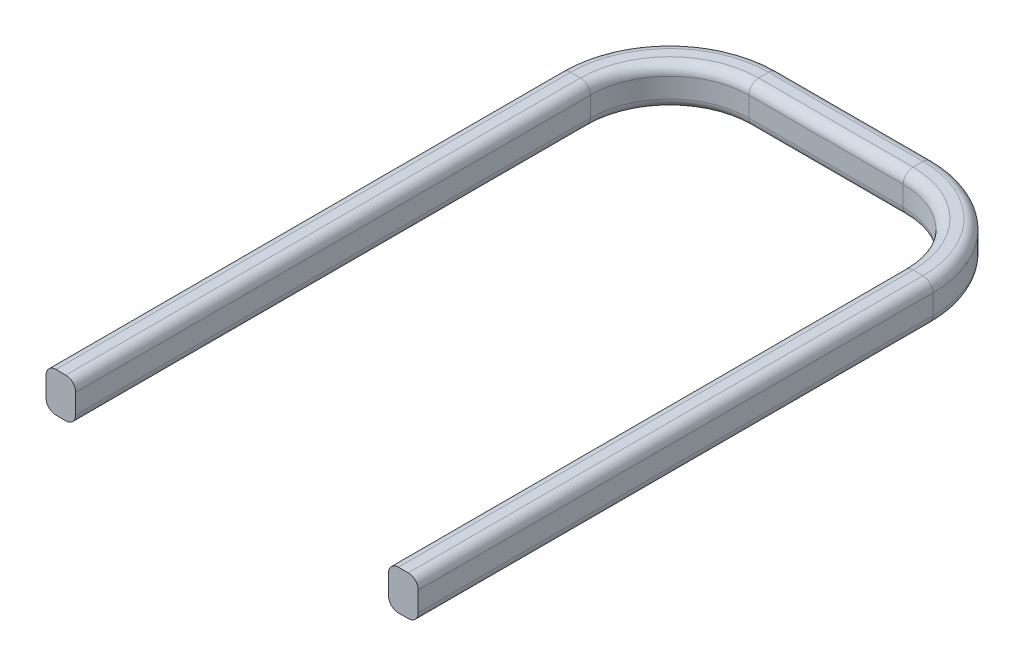
from build123d import *

# Parameters (mm, degrees)
SKETCH2_W = 0.75
SKETCH2_H = 1
FILLET2_R = 0.25


with BuildPart() as part:
    # Sweep1: sweep along a path in Sketch1
    with BuildLine(Plane(origin=(0, 0, 0), x_dir=(1, 0, 0), z_dir=(0, 1, 0))) as sweep1_path:
        Line((-3.95, 0), (-3.95, 13))
        ThreePointArc((-3.95, 13), (-3.364213562, 14.414213562), (-1.95, 15))
        Line((-1.95, 15), (1.95, 15))
        ThreePointArc((1.95, 15), (3.364213562, 14.414213562), (3.95, 13))
        Line((3.95, 13), (3.95, 0))
    # Sketch2 → Sweep1 (sweep)
    with BuildSketch(Plane.XY):
        with Locations((-4.325, 0.5)):
            Rectangle(SKETCH2_W, SKETCH2_H)
    sweep(path=sweep1_path.line)

    # Fillet2
    fillet2_edges = [part.edges().sort_by_distance(p)[0] for p in [
        (3.95, 1, -6.5),
        (4.7, 1, -6.5),
        (4.7, 0, -6.5),
        (-3.95, 0, -6.5),
        (-3.95, 1, -6.5),
        (-4.7, 1, -6.5),
        (-4.7, 0, -6.5),
        (-3.364213562, 0, -14.414213562),
        (-3.364213562, 1, -14.414213562),
        (-3.894543648, 1, -14.944543648),
        (-3.894543648, 0, -14.944543648),
        (0, 0, -15),
        (0, 1, -15),
        (0, 1, -15.75),
        (0, 0, -15.75),
        (3.364213562, 0, -14.414213562),
        (3.364213562, 1, -14.414213562),
        (3.894543648, 1, -14.944543648),
        (3.894543648, 0, -14.944543648),
        (3.95, 0, -6.5),
    ]]
    fillet(fillet2_edges, radius=FILLET2_R)


solid = part.part
